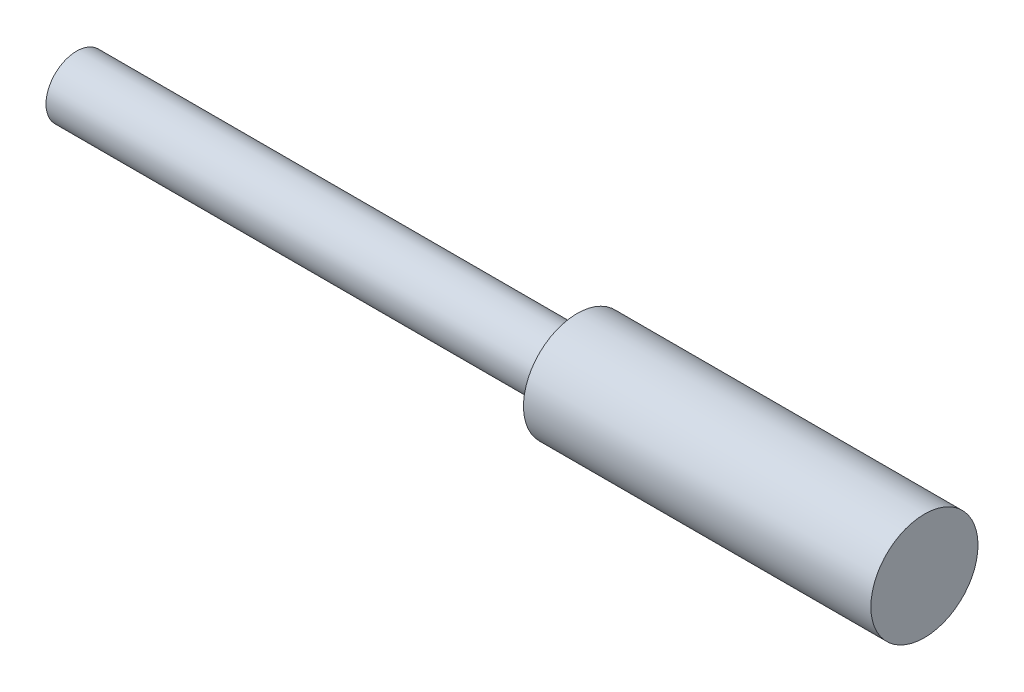
from build123d import *

# Parameters (mm, degrees)
SKETCH3_R           = 2
BASE_EXTRUDE_DEPTH  = 55.4
SKETCH4_R           = 3.5
BOSS_EXTRUDE1_DEPTH = 22.7


with BuildPart() as part:
    # Sketch3 → Base-Extrude (new body)
    with BuildSketch(Plane.ZY.offset(-2551.349581797)):
        with Locations((20.1106, 11.5)):
            Circle(SKETCH3_R)
    extrude(amount=-BASE_EXTRUDE_DEPTH)

    # Sketch4 → Boss-Extrude1 (add)
    with BuildSketch(Plane.ZY.offset(-2606.749581797)):
        with Locations(Location((20.1106, 11.5, 0), (0, 0, 180))):
            Circle(SKETCH4_R)
    extrude(amount=BOSS_EXTRUDE1_DEPTH)


solid = part.part
